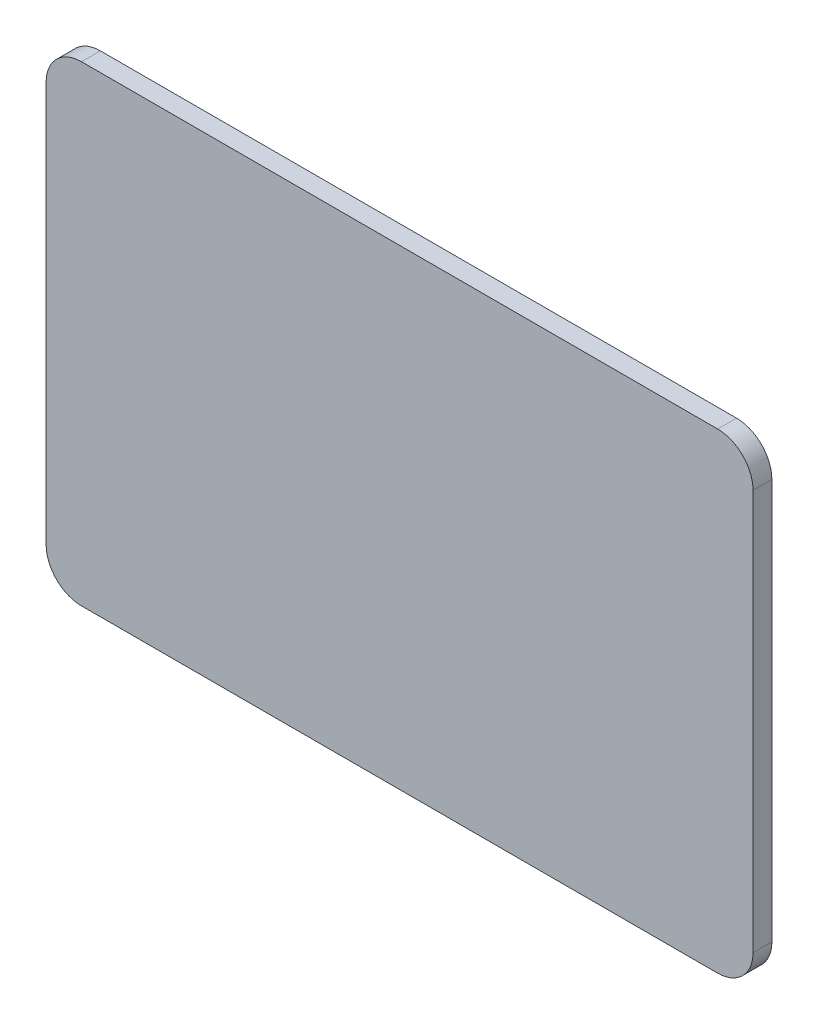
from build123d import *

# Parameters (mm, degrees)
SKETCH_1_W      = 600
SKETCH_1_H      = 400
EXTRUDE_1_DEPTH = 16
FILLET_1_R      = 30


with BuildPart() as part:
    # 草图1 → 凸台-拉伸1 (new body)
    with BuildSketch(Plane.XY):
        Rectangle(SKETCH_1_W, SKETCH_1_H)
    extrude(amount=EXTRUDE_1_DEPTH)

    # 圆角1
    fillet_1_edges = [part.edges().sort_by_distance(p)[0] for p in [
        (-300, 200, 8),
        (300, 200, 8),
        (300, -200, 8),
        (-300, -200, 8),
    ]]
    fillet(fillet_1_edges, radius=FILLET_1_R)


solid = part.part
